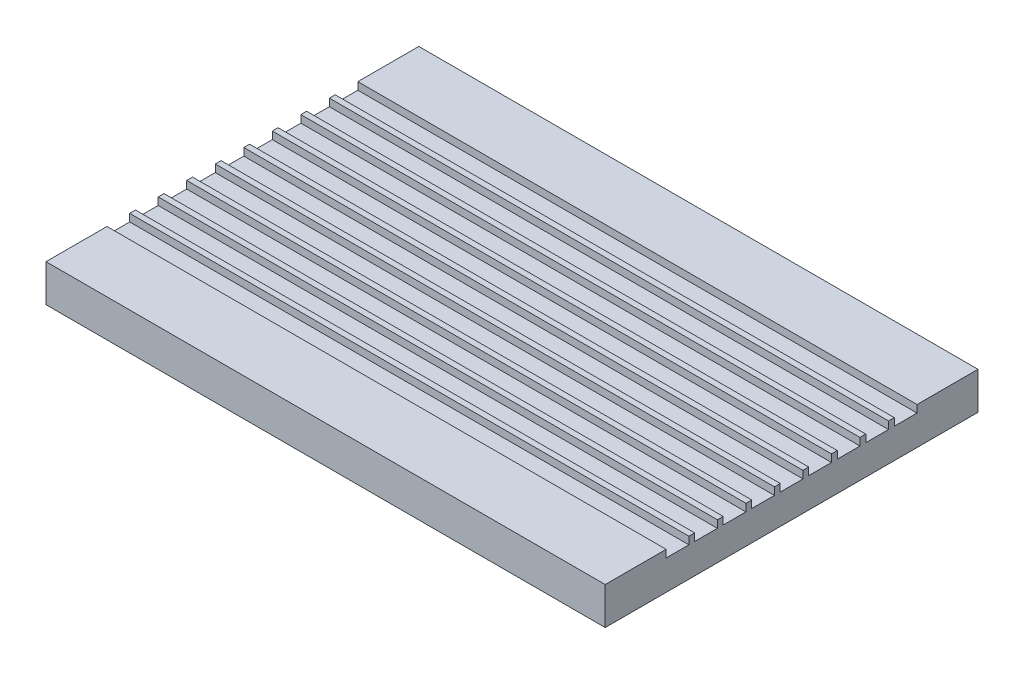
from build123d import *

# Parameters (mm, degrees)
SKETCH1_W           = 300
SKETCH1_H           = 200
BOSS_EXTRUDE1_DEPTH = 20
SKETCH2_W           = 12.2
SKETCH2_H           = 4
CUT_EXTRUDE1_DEPTH  = 317.859590355
LPATTERN1_COUNT     = 9
LPATTERN1_PITCH     = 15.300152


with BuildPart() as part:
    # Sketch1 → Boss-Extrude1 (new body)
    with BuildSketch(Plane(origin=(0, 0, 0), x_dir=(1, 0, 0), z_dir=(0, 1, 0))):
        Rectangle(SKETCH1_W, SKETCH1_H)
    extrude(amount=-BOSS_EXTRUDE1_DEPTH)

    # Sketch2 → Cut-Extrude1 (cut, through all)
    with BuildSketch(Plane(origin=(150, 0, 0), x_dir=(0, 0, -1), z_dir=(1, 0, 0))):
        with Locations((-61.200608, -2)):
            Rectangle(SKETCH2_W, SKETCH2_H)
    cut_extrude1 = extrude(amount=-CUT_EXTRUDE1_DEPTH, mode=Mode.SUBTRACT)

    # LPattern1: Cut-Extrude1 ×9
    with Locations(*[(0, 0, -i * LPATTERN1_PITCH) for i in range(1, LPATTERN1_COUNT)]):
        add(cut_extrude1, mode=Mode.SUBTRACT)


solid = part.part
